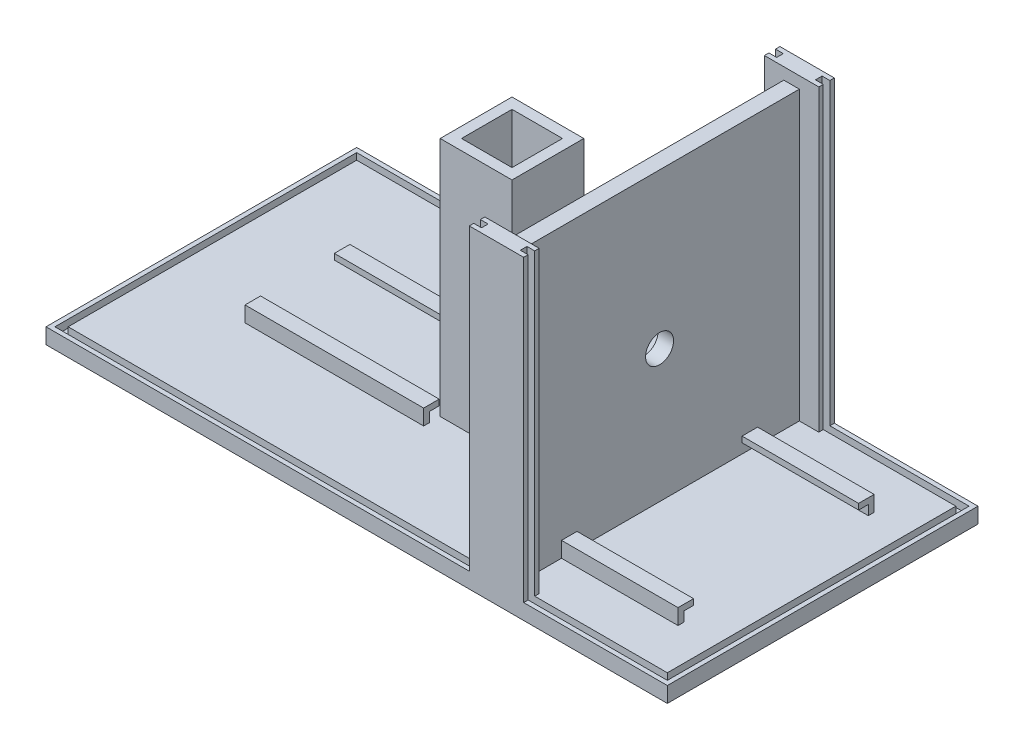
from build123d import *

# Parameters (mm, degrees)
IZIM1_W                        = 160
IZIM1_H                        = 80
Y_KSEKLIK_EKSTR_ZYON1_DEPTH    = 4
IZIM2_W                        = 18.5
IZIM2_H                        = 18.5
Y_KSEKLIK_EKSTR_ZYON2_DEPTH    = 62
IZIM3_W                        = 13
IZIM3_H                        = 13
KES_EKSTR_ZYON1_DEPTH          = 33
IZIM4_R                        = 3.6
KES_EKSTR_ZYON3_DEPTH          = 9.161851858
IZIM6_R                        = 2.5
KES_EKSTR_ZYON4_DEPTH          = 35
IZIM10_W                       = 5
IZIM10_H                       = 4
Y_KSEKLIK_EKSTR_ZYON5_DEPTH    = 77
IZIM11_R                       = 3.6
KES_EKSTR_ZYON6_DEPTH          = 5
IZIM12_W                       = 2
IZIM12_H                       = 1.7
KES_EKSTR_ZYON7_DEPTH          = 79
IZIM13_W                       = 106.15
IZIM13_H                       = 1.7
IZIM13_W_2                     = 1.7
IZIM13_H_2                     = 74.3
KES_EKSTR_ZYON8_DEPTH          = 2
IZIM14_W                       = 46
IZIM14_H                       = 4
Y_KSEKLIK_EKSTR_ZYON13_DEPTH   = 4
Y_KSEKLIK_EKSTR_ZYON13_2_DEPTH = 4
IZIM15_W                       = 2.5
IZIM15_H                       = 2.5
KES_EKSTR_ZYON9_DEPTH          = 46
IZIM16_W                       = 30
IZIM16_H                       = 4
Y_KSEKLIK_EKSTR_ZYON14_DEPTH   = 4
IZIM17_W                       = 2.5
IZIM17_H                       = 2.5
KES_EKSTR_ZYON10_DEPTH         = 30
IZIM18_W                       = 5
IZIM18_H                       = 4
Y_KSEKLIK_EKSTR_ZYON15_DEPTH   = 77
IZIM20_W                       = 2
IZIM20_H                       = 1.7
KES_EKSTR_ZYON11_DEPTH         = 79
IZIM21_W                       = 34.15
IZIM21_H                       = 1.7
IZIM21_W_2                     = 1.7
IZIM21_H_2                     = 74.3
KES_EKSTR_ZYON12_DEPTH         = 2
IZIM22_W                       = 4
IZIM22_H                       = 72
KES_EKSTR_ZYON13_DEPTH         = 3


with BuildPart() as part:
    # Çizim1 → Yükseklik-Ekstrüzyon1 (new body)
    with BuildSketch(Plane(origin=(0, 0, 0), x_dir=(1, 0, 0), z_dir=(0, 1, 0))):
        Rectangle(IZIM1_W, IZIM1_H)
    extrude(amount=Y_KSEKLIK_EKSTR_ZYON1_DEPTH)

    # Çizim2 → Yükseklik-Ekstrüzyon2 (add)
    with BuildSketch(Plane(origin=(0, 4, 0), x_dir=(1, 0, 0), z_dir=(0, 1, 0))):
        Rectangle(IZIM2_W, IZIM2_H)
    extrude(amount=Y_KSEKLIK_EKSTR_ZYON2_DEPTH)

    # Çizim3 → Kes-Ekstrüzyon1 (cut)
    with BuildSketch(Plane(origin=(0, 66, 0), x_dir=(1, 0, 0), z_dir=(0, 1, 0))):
        Rectangle(IZIM3_W, IZIM3_H)
    extrude(amount=-KES_EKSTR_ZYON1_DEPTH, mode=Mode.SUBTRACT)

    # Çizim4 → Kes-Ekstrüzyon3 (cut)
    with BuildSketch(Plane(origin=(9.25, 0, 0), x_dir=(0, 0, -1), z_dir=(1, 0, 0))):
        with Locations((0, 38.12)):
            Circle(IZIM4_R)
    extrude(amount=-KES_EKSTR_ZYON3_DEPTH, mode=Mode.SUBTRACT)

    # Çizim6 → Kes-Ekstrüzyon4 (cut)
    with BuildSketch(Plane.ZY.offset(9.25)):
        with Locations((0, 38.12)):
            Circle(IZIM6_R)
    extrude(amount=-KES_EKSTR_ZYON4_DEPTH, mode=Mode.SUBTRACT)

    # Çizim10 → Yükseklik-Ekstrüzyon5 (add)
    with BuildSketch(Plane(origin=(0, 4, 0), x_dir=(1, 0, 0), z_dir=(0, 1, 0))):
        Polygon((34, -40), (38, -40), (38, 40), (34, 40), (34, 36), (34, -36), align=None)
        with Locations((31.5, 38)):
            Rectangle(IZIM10_W, IZIM10_H)
        with Locations((31.5, -38)):
            Rectangle(IZIM10_W, IZIM10_H)
    extrude(amount=Y_KSEKLIK_EKSTR_ZYON5_DEPTH)

    # Çizim11 → Kes-Ekstrüzyon6 (cut)
    with BuildSketch(Plane(origin=(38, 0, 0), x_dir=(0, 0, -1), z_dir=(1, 0, 0))):
        with Locations((0, 38.12)):
            Circle(IZIM11_R)
    extrude(amount=-KES_EKSTR_ZYON6_DEPTH, mode=Mode.SUBTRACT)

    # Çizim12 → Kes-Ekstrüzyon7 (cut)
    with BuildSketch(Plane(origin=(0, 81, 0), x_dir=(1, 0, 0), z_dir=(0, 1, 0))):
        with Locations((30, -38)):
            Rectangle(IZIM12_W, IZIM12_H)
        with Locations((30, 38)):
            Rectangle(IZIM12_W, IZIM12_H)
    extrude(amount=-KES_EKSTR_ZYON7_DEPTH, mode=Mode.SUBTRACT)

    # Çizim13 → Kes-Ekstrüzyon8 (cut)
    with BuildSketch(Plane(origin=(0, 4, 0), x_dir=(1, 0, 0), z_dir=(0, 1, 0))):
        with Locations((-24.075, -38)):
            Rectangle(IZIM13_W, IZIM13_H)
        with Locations((-78, 0)):
            Rectangle(IZIM13_W_2, IZIM13_H_2)
        with Locations((-78, -38)):
            Rectangle(IZIM13_W_2, IZIM13_H)
        with Locations((-24.075, 38)):
            Rectangle(IZIM13_W, IZIM13_H)
        with Locations((-78, 38)):
            Rectangle(IZIM13_W_2, IZIM13_H)
    extrude(amount=-KES_EKSTR_ZYON8_DEPTH, mode=Mode.SUBTRACT)

    # Çizim16 → Yükseklik-Ekstrüzyon14 (add)
    with BuildSketch(Plane(origin=(0, 4, 0), x_dir=(1, 0, 0), z_dir=(0, 1, 0))):
        with Locations((53, 23.25)):
            Rectangle(IZIM16_W, IZIM16_H)
        with Locations((53, -23.25)):
            Rectangle(IZIM16_W, IZIM16_H)
    extrude(amount=Y_KSEKLIK_EKSTR_ZYON14_DEPTH)

    # Çizim17 → Kes-Ekstrüzyon10 (cut)
    with BuildSketch(Plane(origin=(68, 0, 0), x_dir=(0, 0, -1), z_dir=(1, 0, 0))):
        with Locations((-22.5, 5.25)):
            Rectangle(IZIM17_W, IZIM17_H)
        with Locations((22.5, 5.25)):
            Rectangle(IZIM17_W, IZIM17_H)
    extrude(amount=-KES_EKSTR_ZYON10_DEPTH, mode=Mode.SUBTRACT)

    # Çizim18 → Yükseklik-Ekstrüzyon15 (add)
    with BuildSketch(Plane(origin=(0, 4, 0), x_dir=(1, 0, 0), z_dir=(0, 1, 0))):
        with Locations((40.5, 38)):
            Rectangle(IZIM18_W, IZIM18_H)
        with Locations((40.5, -38)):
            Rectangle(IZIM18_W, IZIM18_H)
    extrude(amount=Y_KSEKLIK_EKSTR_ZYON15_DEPTH)

    # Çizim20 → Kes-Ekstrüzyon11 (cut)
    with BuildSketch(Plane(origin=(0, 81, 0), x_dir=(1, 0, 0), z_dir=(0, 1, 0))):
        with Locations((42, -38)):
            Rectangle(IZIM20_W, IZIM20_H)
        with Locations((42, 38)):
            Rectangle(IZIM20_W, IZIM20_H)
    extrude(amount=-KES_EKSTR_ZYON11_DEPTH, mode=Mode.SUBTRACT)

    # Çizim21 → Kes-Ekstrüzyon12 (cut)
    with BuildSketch(Plane(origin=(0, 4, 0), x_dir=(1, 0, 0), z_dir=(0, 1, 0))):
        with Locations((60.075, -38)):
            Rectangle(IZIM21_W, IZIM21_H)
        with Locations((78, -38)):
            Rectangle(IZIM21_W_2, IZIM21_H)
        with Locations((78, 0)):
            Rectangle(IZIM21_W_2, IZIM21_H_2)
        with Locations((60.075, 38)):
            Rectangle(IZIM21_W, IZIM21_H)
        with Locations((78, 38)):
            Rectangle(IZIM21_W_2, IZIM21_H)
    extrude(amount=-KES_EKSTR_ZYON12_DEPTH, mode=Mode.SUBTRACT)

    # Çizim22 → Kes-Ekstrüzyon13 (cut)
    with BuildSketch(Plane(origin=(0, 81, 0), x_dir=(1, 0, 0), z_dir=(0, 1, 0))):
        with Locations((36, 0)):
            Rectangle(IZIM22_W, IZIM22_H)
    extrude(amount=-KES_EKSTR_ZYON13_DEPTH, mode=Mode.SUBTRACT)


with BuildPart() as body_2:
    # Çizim14 → Yükseklik-Ekstrüzyon13 (new body)
    with BuildSketch(Plane(origin=(0, 4, 0), x_dir=(1, 0, 0), z_dir=(0, 1, 0))):
        with Locations((-32.25, -11.5)):
            Rectangle(IZIM14_W, IZIM14_H)
    extrude(amount=Y_KSEKLIK_EKSTR_ZYON13_DEPTH)


with BuildPart() as body_3:
    # Çizim14 → Y_kseklik-Ekstr_zyon13 2 (new body)
    with BuildSketch(Plane(origin=(0, 4, 0), x_dir=(1, 0, 0), z_dir=(0, 1, 0))):
        with Locations((-32.25, 11.5)):
            Rectangle(IZIM14_W, IZIM14_H)
    extrude(amount=Y_KSEKLIK_EKSTR_ZYON13_2_DEPTH)


with BuildPart() as kes_ekstr_zyon9_tool:
    # Çizim15 → Kes-Ekstrüzyon9 (new body)
    with BuildSketch(Plane.ZY.offset(55.25)):
        with Locations((-10.75, 5.25)):
            Rectangle(IZIM15_W, IZIM15_H)
        with Locations((10.75, 5.25)):
            Rectangle(IZIM15_W, IZIM15_H)
    extrude(amount=-KES_EKSTR_ZYON9_DEPTH)


with BuildPart() as body_2_1:
    add(body_2.part)

    # Kes-Ekstrüzyon9: cut by kes_ekstr_zyon9_tool
    add(kes_ekstr_zyon9_tool.part, mode=Mode.SUBTRACT)


with BuildPart() as body_3_1:
    add(body_3.part)

    # Kes-Ekstrüzyon9: cut by kes_ekstr_zyon9_tool
    add(kes_ekstr_zyon9_tool.part, mode=Mode.SUBTRACT)


solid = Compound([part.part, body_2_1.part, body_3_1.part])
